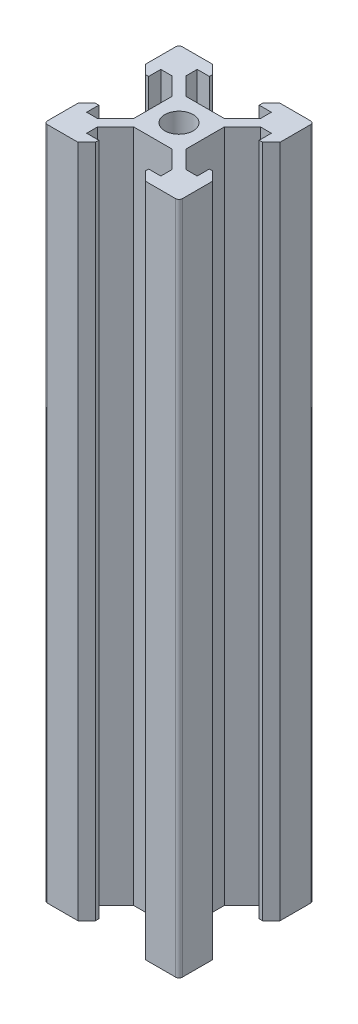
from build123d import *

# Parameters (mm, degrees)
SKETCH2_W           = 20
SKETCH2_H           = 20
SKETCH2_R           = 2.1
BOSS_EXTRUDE1_DEPTH = 100
CUT_EXTRUDE1_DEPTH  = 101.995049384
FILLET1_R           = 0.5


with BuildPart() as part:
    # Sketch2 → Boss-Extrude1 (new body)
    with BuildSketch(Plane(origin=(0, 0, 0), x_dir=(1, 0, 0), z_dir=(0, 1, 0))):
        Rectangle(SKETCH2_W, SKETCH2_H)
        with Locations(Location((0, 0, 0), (0, 0, 270))):
            Circle(SKETCH2_R, mode=Mode.SUBTRACT)
    extrude(amount=-BOSS_EXTRUDE1_DEPTH)

    # Sketch3 → Cut-Extrude1 (cut, through all)
    with BuildSketch(Plane(origin=(0, 0, 0), x_dir=(1, 0, 0), z_dir=(0, 1, 0))):
        Polygon((5.5, -6.551650429), (2.848349571, -3.9), (-2.848349571, -3.9), (-5.5, -6.551650429), (-5.5, -8.2), (-3.7, -8.2), (-3.7, -8.7), (-5, -10), (5, -10), (3.7, -8.7), (3.7, -8.2), (5.5, -8.2), align=None)
        Polygon((3.9, 2.848349571), (3.9, -2.848349571), (6.551650429, -5.5), (8.2, -5.5), (8.2, -3.7), (8.7, -3.7), (10, -5), (10, 5), (8.7, 3.7), (8.2, 3.7), (8.2, 5.5), (6.551650429, 5.5), align=None)
        Polygon((-6.551650429, -5.5), (-3.9, -2.848349571), (-3.9, 2.848349571), (-6.551650429, 5.5), (-8.2, 5.5), (-8.2, 3.7), (-8.7, 3.7), (-10, 5), (-10, -5), (-8.7, -3.7), (-8.2, -3.7), (-8.2, -5.5), align=None)
        Polygon((-2.848349571, 3.9), (2.848349571, 3.9), (5.5, 6.551650429), (5.5, 8.2), (3.7, 8.2), (3.7, 8.7), (5, 10), (-5, 10), (-3.7, 8.7), (-3.7, 8.2), (-5.5, 8.2), (-5.5, 6.551650429), align=None)
    extrude(amount=-CUT_EXTRUDE1_DEPTH, mode=Mode.SUBTRACT)

    # Fillet1
    fillet1_edges = [part.edges().sort_by_distance(p)[0] for p in [
        (-10, -50, -10),
        (10, -50, -10),
        (10, -50, 10),
        (-10, -50, 10),
    ]]
    fillet(fillet1_edges, radius=FILLET1_R)


solid = part.part
